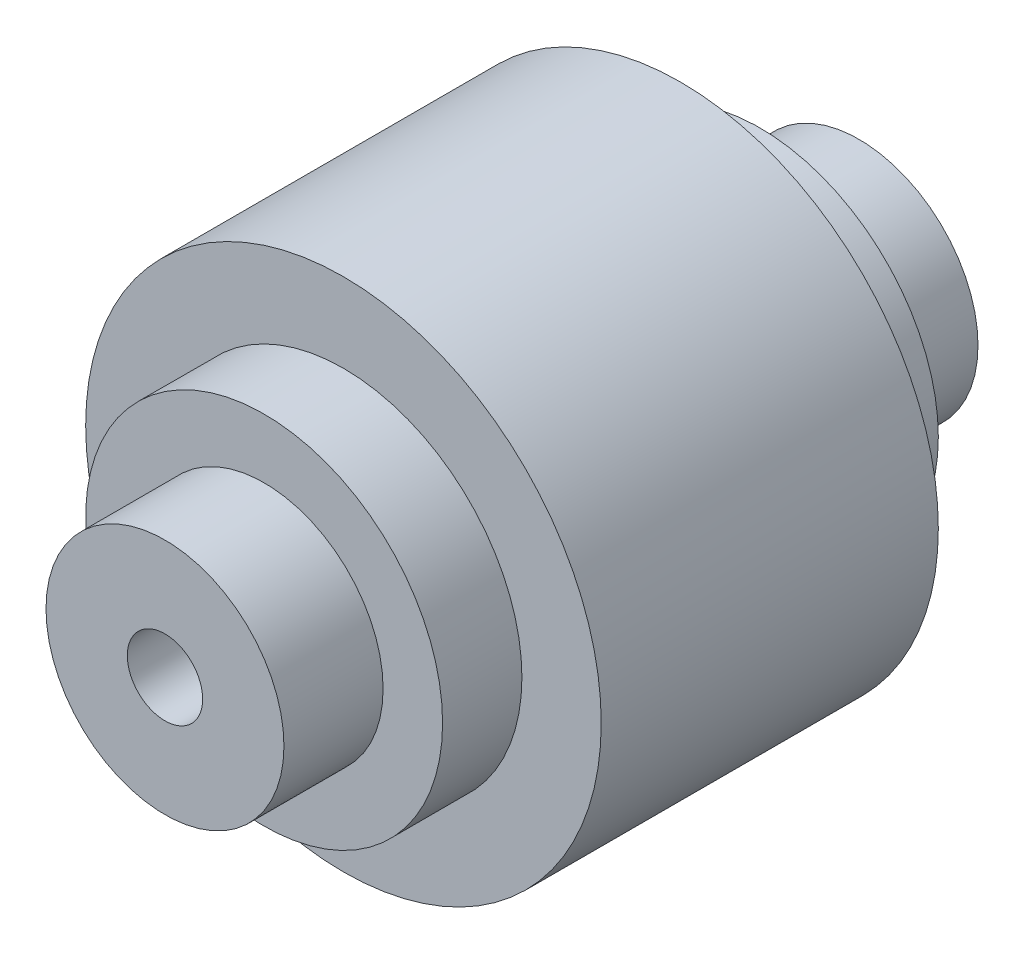
from build123d import *

# Parameters (mm, degrees)
SKETCH_2_R           = 1.9
CUT_EXTRUDE_1_DEPTH  = 36
EXTRUDE_1_DEPTH      = 4
EXTRUDE_1_DEPTH_BACK = 21
SKETCH_4_R           = 9


with BuildPart() as part:
    # 草图1 → 旋转1 (revolve)
    with BuildSketch(Plane(origin=(0, 0, 0), x_dir=(1, 0, 0), z_dir=(0, 1, 0)), mode=Mode.PRIVATE) as revolve_1_sk:
        Polygon((0, -1e-09), (0, -35), (6, -35), (6, -30), (7.5, -30), (7.5, -26), (9, -26), (13, -26), (13, -9), (9, -9), (7.5, -9), (7.5, -5), (6, -5), (6, -1e-09), align=None)
    revolve(revolve_1_sk.sketch.rotate(Axis((0, 0, 1e-09), (0, 0, 1)), 180), axis=Axis((0, 0, 1e-09), (0, 0, 1)))

    # 草图2 → 切除-拉伸1 (cut)
    with BuildSketch(Plane.XY.offset(35)):
        Circle(SKETCH_2_R)
    extrude(amount=-CUT_EXTRUDE_1_DEPTH, mode=Mode.SUBTRACT)

    # 草图4 → 凸台-拉伸1 (add, two sides: drawn at the far end of the back side and taken through both)
    with BuildSketch(Plane.XY.offset(26).offset(-EXTRUDE_1_DEPTH_BACK)):
        Circle(SKETCH_4_R)
    extrude(amount=EXTRUDE_1_DEPTH + EXTRUDE_1_DEPTH_BACK)


solid = part.part
